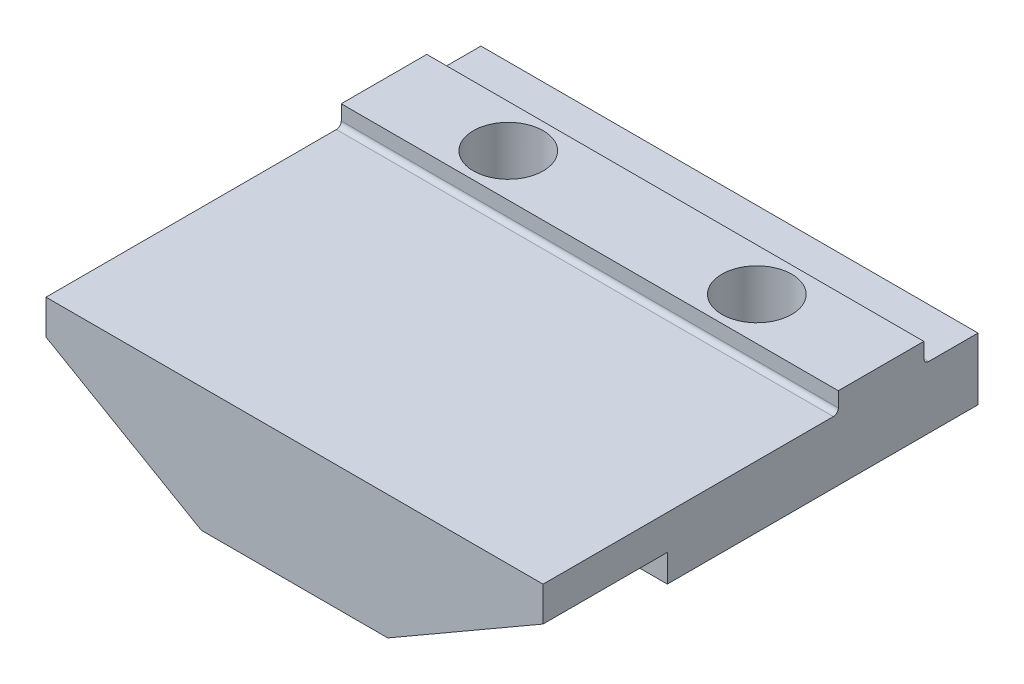
from build123d import *

# Parameters (mm, degrees)
SKETCH1_W           = 50.8
SKETCH1_H           = 44.45
BOSS_EXTRUDE1_DEPTH = 3.175
BOSS_EXTRUDE2_START = -3.175
SKETCH2_W           = 50.8
SKETCH2_H           = 12.7
BOSS_EXTRUDE2_DEPTH = 6.35
BOSS_EXTRUDE3_START = 3.175
SKETCH3_W           = 50.8
SKETCH3_H           = 8.7376
BOSS_EXTRUDE3_DEPTH = 2.032
CUT_EXTRUDE2_START  = 22.225
CUT_EXTRUDE2_DEPTH  = 12.7
CUT_EXTRUDE4_START  = 22.225
CUT_EXTRUDE4_DEPTH  = 12.7
CUT_EXTRUDE6_START  = 5.207
SKETCH6_R           = 3.5687
CUT_EXTRUDE6_DEPTH  = 9.525
FILLET1_R           = 0.508


with BuildPart() as part:
    # Sketch1 → Boss-Extrude1 (new, symmetric)
    with BuildSketch(Plane(origin=(0, 0, 0), x_dir=(1, 0, 0), z_dir=(0, 1, 0))):
        Rectangle(SKETCH1_W, SKETCH1_H)
    extrude(amount=BOSS_EXTRUDE1_DEPTH, both=True)

    # Sketch2 → Boss-Extrude2 (add)
    with BuildSketch(Plane(origin=(0, 0, 0), x_dir=(1, 0, 0), z_dir=(0, 1, 0)).offset(BOSS_EXTRUDE2_START)):
        with Locations((0, -15.875)):
            Rectangle(SKETCH2_W, SKETCH2_H)
    extrude(amount=-BOSS_EXTRUDE2_DEPTH)

    # Sketch3 → Boss-Extrude3 (add)
    with BuildSketch(Plane(origin=(0, 0, 0), x_dir=(1, 0, 0), z_dir=(0, 1, 0)).offset(BOSS_EXTRUDE3_START)):
        with Locations((0, 12.319)):
            Rectangle(SKETCH3_W, SKETCH3_H)
    extrude(amount=BOSS_EXTRUDE3_DEPTH)

    # Sketch4 → Cut-Extrude2 (cut)
    with BuildSketch(Plane.XY.offset(CUT_EXTRUDE2_START)):
        Polygon((-76.2, -22.225), (-9.525, -22.225), (-9.525, -9.525), (-76.2, 28.969829198), align=None)
    extrude(amount=-CUT_EXTRUDE2_DEPTH, mode=Mode.SUBTRACT)

    # Sketch5 → Cut-Extrude4 (cut)
    with BuildSketch(Plane.XY.offset(CUT_EXTRUDE4_START)):
        Polygon((9.525, -22.225), (76.2, -22.225), (76.2, 28.969829198), (9.525, -9.525), align=None)
    extrude(amount=-CUT_EXTRUDE4_DEPTH, mode=Mode.SUBTRACT)

    # Sketch6 → Cut-Extrude6 (cut)
    with BuildSketch(Plane(origin=(0, 0, 0), x_dir=(1, 0, 0), z_dir=(0, 1, 0)).offset(CUT_EXTRUDE6_START)):
        with Locations(Location((-12.7, 12.319, 0), (0, 0, 270))):
            Circle(SKETCH6_R)
        with Locations(Location((12.7, 12.319, 0), (0, 0, 270))):
            Circle(SKETCH6_R)
    extrude(amount=-CUT_EXTRUDE6_DEPTH, mode=Mode.SUBTRACT)

    # Fillet1
    fillet1_edges = [part.edges().sort_by_distance(p)[0] for p in [
        (0, 3.175, -7.9502),
        (0, 3.175, -16.6878),
    ]]
    fillet(fillet1_edges, radius=FILLET1_R)


solid = part.part
